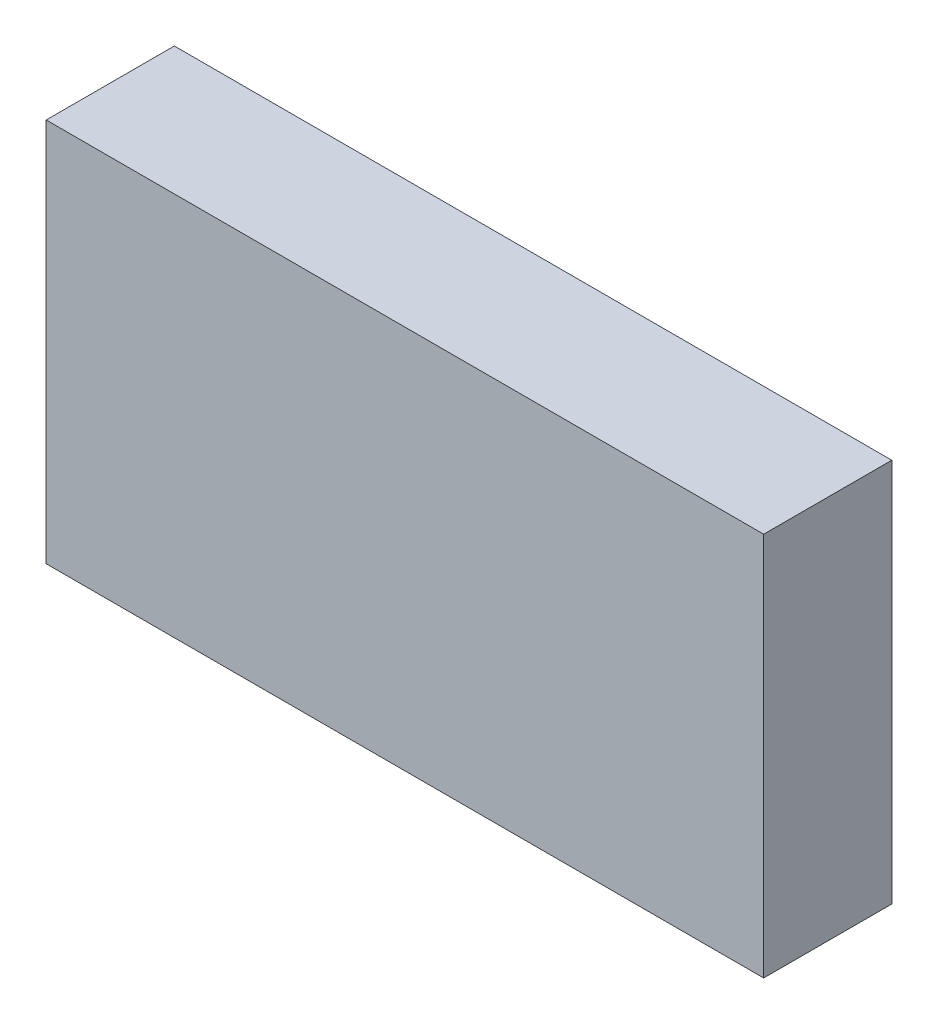
from build123d import *

# Parameters (mm, degrees)
ESQUISSE1_W        = 56
ESQUISSE1_H        = 30
BOSS_EXTRU_1_DEPTH = 10


with BuildPart() as part:
    # Esquisse1 → Boss.-Extru.1 (new body)
    with BuildSketch(Plane.XY):
        with Locations((-0.708209438, 0.529411765)):
            Rectangle(ESQUISSE1_W, ESQUISSE1_H)
    extrude(amount=BOSS_EXTRU_1_DEPTH)


solid = part.part
